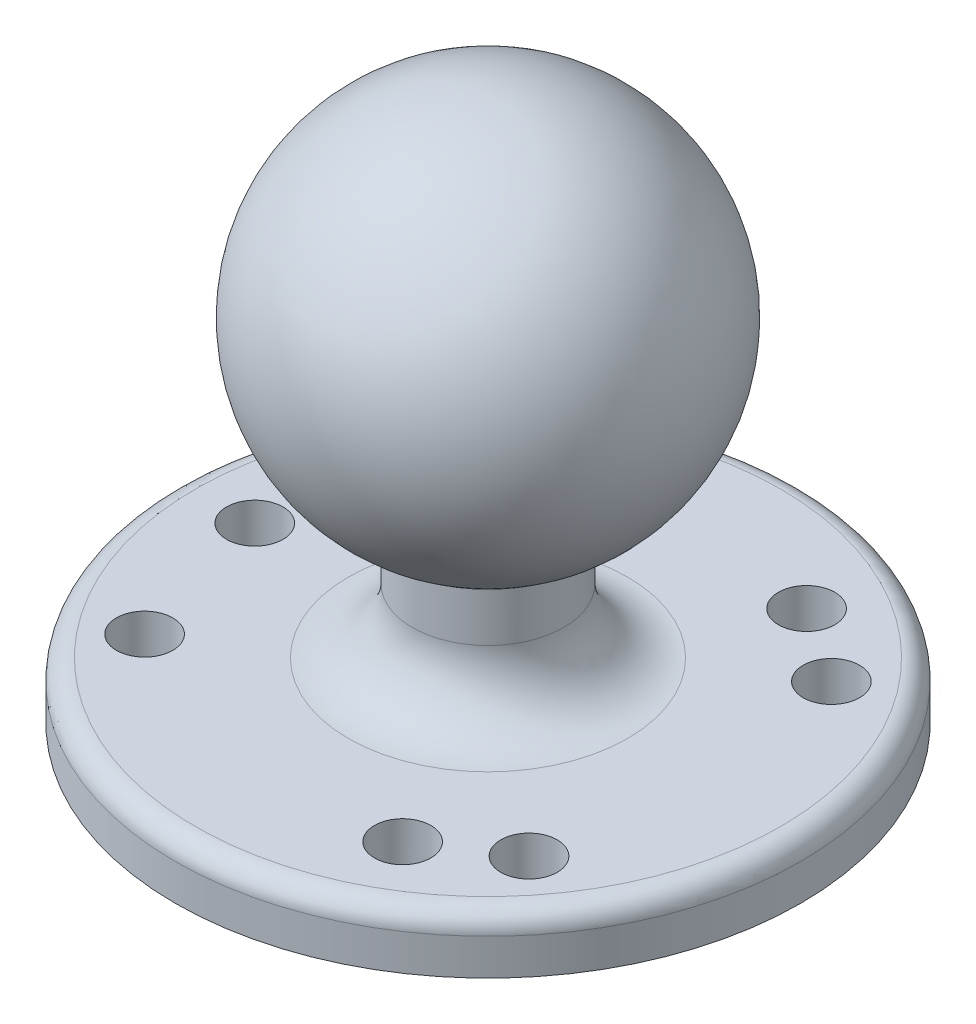
from build123d import *

# Parameters (mm, degrees)
SKETCH2_R          = 2.794
CUT_EXTRUDE1_DEPTH = 10


with BuildPart() as part:
    # Sketch1 → Revolve1 (revolve)
    with BuildSketch(Plane.XY, mode=Mode.PRIVATE) as revolve1_sk:
        with BuildLine():
            Line((0, 0), (30.988, 0))
            Line((30.988, 0), (30.988, 3.588))
            ThreePointArc((30.988, 3.588), (30.402213562, 5.002213562), (28.988, 5.588))
            Line((28.988, 5.588), (13.85, 5.588))
            ThreePointArc((13.85, 5.588), (9.359871939, 7.447871939), (7.5, 11.938))
            Line((7.5, 11.938), (7.5, 17.286503776))
            ThreePointArc((7.5, 17.286503776), (18.661410759, 38.626086789), (0, 53.848))
            Line((0, 53.848), (0, 0))
        make_face()
    revolve(revolve1_sk.sketch.rotate(Axis((0, 0, 0), (0, 1, 0)), 90), axis=Axis((0, 0, 0), (0, 1, 0)))

    # Sketch2 → Cut-Extrude1 (cut)
    with BuildSketch(Plane.XZ):
        with Locations(Location((-23.114, 0, 0), (0, 0, 270))):
            Circle(SKETCH2_R)
        with Locations(Location((11.557, 20.017311183, 0), (0, 0, 270))):
            Circle(SKETCH2_R)
        with Locations(Location((11.557, -20.017311183, 0), (0, 0, 270))):
            Circle(SKETCH2_R)
        with Locations(Location((-19.05, 14.986, 0), (0, 0, 270))):
            Circle(SKETCH2_R)
        with Locations(Location((19.05, 14.986, 0), (0, 0, 270))):
            Circle(SKETCH2_R)
        with Locations(Location((19.05, -14.986, 0), (0, 0, 270))):
            Circle(SKETCH2_R)
        with Locations(Location((-19.05, -14.986, 0), (0, 0, 270))):
            Circle(SKETCH2_R)
    extrude(amount=-CUT_EXTRUDE1_DEPTH, mode=Mode.SUBTRACT)


solid = part.part
